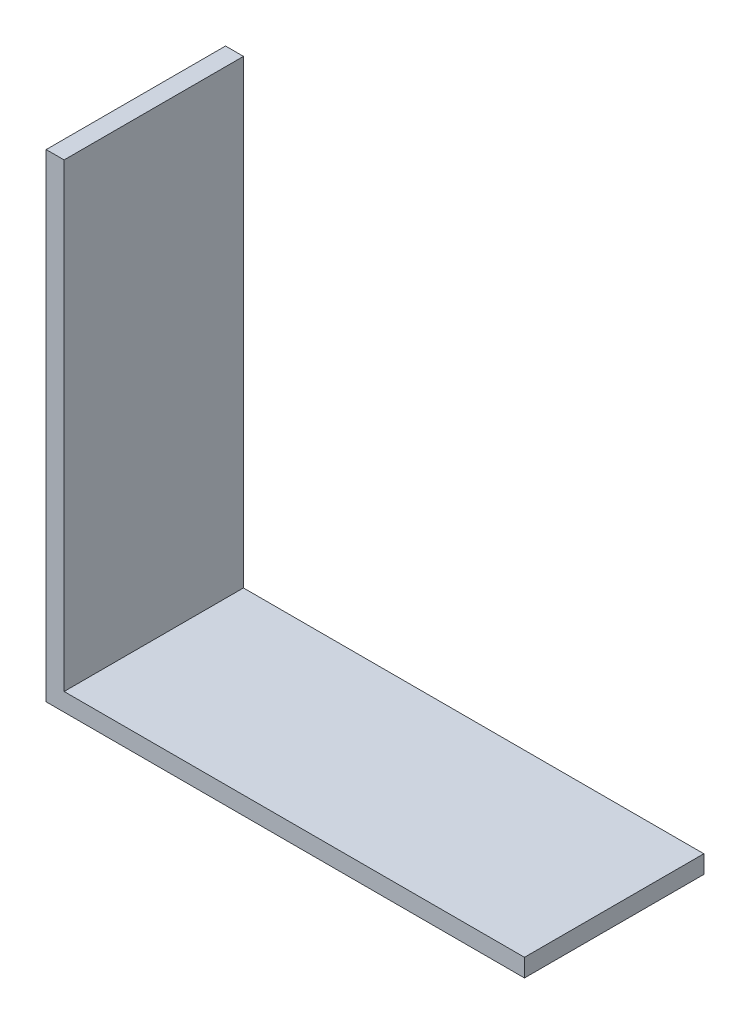
from build123d import *

# Parameters (mm, degrees)
EXTRUDE_1_DEPTH = 15


with BuildPart() as part:
    # Эскиз1 → Бобышка-Вытянуть1 (new body)
    with BuildSketch(Plane.XY):
        Polygon((0, 0), (40, 0), (40, 1.5), (1.5, 1.5), (1.5, 40), (0, 40), align=None)
    extrude(amount=EXTRUDE_1_DEPTH)


solid = part.part
